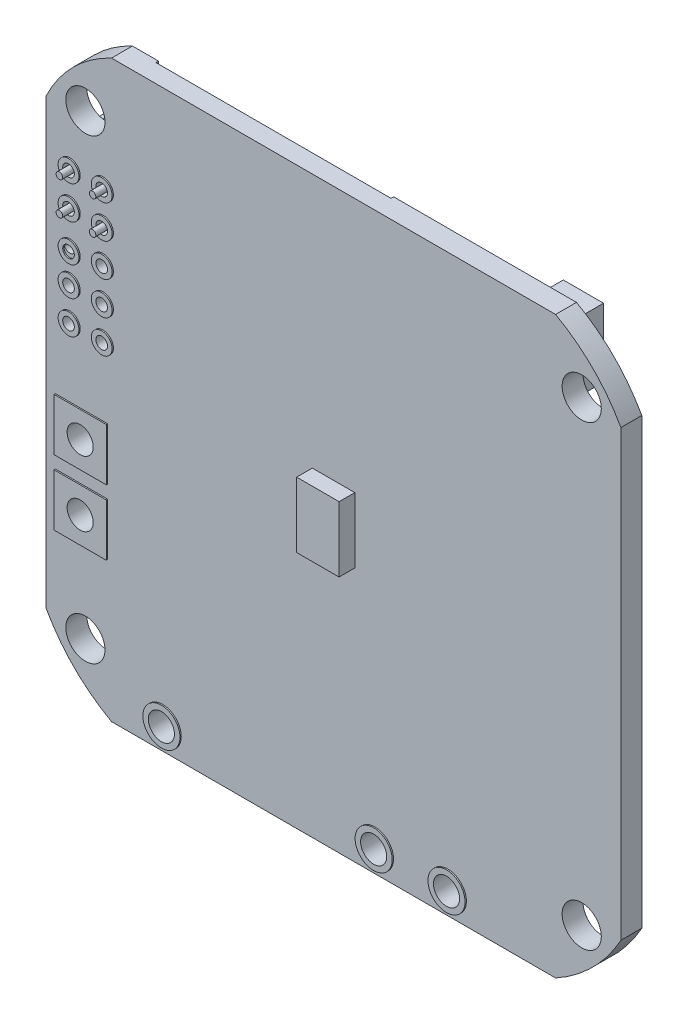
from build123d import *

# Parameters (mm, degrees)
SALIENTE_EXTRUIR1_DEPTH    = 0.8
CROQUIS2_R                 = 1.5
CORTAR_EXTRUIR1_DEPTH      = 32.153811966
CROQUIS3_W                 = 3.25
CROQUIS3_H                 = 5
SALIENTE_EXTRUIR2_DEPTH    = 1.2
CROQUIS4_R                 = 0.445
CORTAR_EXTRUIR2_DEPTH      = 32.238437861
CROQUIS5_R                 = 0.79739254
CROQUIS5_R_2               = 0.445
CROQUIS5_W                 = 4
CROQUIS5_H                 = 4
SALIENTE_EXTRUIR3_DEPTH    = 0.9
CORTAR_EXTRUIR3_DEPTH      = 32.247559905
CORTAR_EXTRUIR3_DEPTH_BACK = 32.247559905
CROQUIS6_R                 = 1
CROQUIS7_R                 = 1
CORTAR_EXTRUIR4_DEPTH      = 10
CROQUIS8_W                 = 3
CROQUIS8_H                 = 2.5
SALIENTE_EXTRUIR4_DEPTH    = 1.2
CROQUIS9_R                 = 0.75
SALIENTE_EXTRUIR5_DEPTH    = 0.8
CROQUIS10_W                = 5
CROQUIS10_H                = 5
SALIENTE_EXTRUIR6_DEPTH    = 0.9
SALIENTE_EXTRUIR7_START    = 0.1
CROQUIS11_R                = 1
SALIENTE_EXTRUIR7_DEPTH    = 0.1
SALIENTE_EXTRUIR8_DEPTH    = 0.75
CROQUIS13_W                = 3.080395022
CROQUIS13_H                = 5.233680862
SALIENTE_EXTRUIR9_DEPTH    = 2.65
CROQUIS14_W                = 3.82
CROQUIS14_H                = 3.82
SALIENTE_EXTRUIR10_DEPTH   = 3
CROQUIS30_R                = 1.419915385
CROQUIS30_R_2              = 1
SALIENTE_EXTRUIR17_DEPTH   = 0.1
CROQUIS29_W                = 3.5
CROQUIS29_H                = 1.5
SALIENTE_EXTRUIR16_DEPTH   = 0.5
CHAFL_N1_SIZE              = 1
CROQUIS31_W                = 18
CROQUIS31_H                = 19.35
CORTAR_EXTRUIR5_DEPTH      = 0.2
CROQUIS32_R                = 0.65
SALIENTE_EXTRUIR18_DEPTH   = 1.6
CROQUIS33_R                = 0.25
SALIENTE_EXTRUIR19_DEPTH   = 2.5
CROQUIS34_R                = 0.65
CROQUIS34_R_2              = 0.64
CROQUIS34_R_3              = 0.664142136
SALIENTE_EXTRUIR20_DEPTH   = 3


with BuildPart() as part:
    # Croquis1 → Saliente-Extruir1 (new, symmetric)
    with BuildSketch(Plane.XY):
        with BuildLine():
            Line((-22, 17), (-22, -17))
            ThreePointArc((-22, -17), (-19.853553391, -19.853553391), (-17, -22))
            Line((-17, -22), (17, -22))
            ThreePointArc((17, -22), (19.853553391, -19.853553391), (22, -17))
            Line((22, -17), (22, 17))
            ThreePointArc((22, 17), (19.853553391, 19.853553391), (17, 22))
            Line((17, 22), (-17, 22))
            ThreePointArc((-17, 22), (-19.933555475, 19.933555475), (-22, 17))
        make_face()
    extrude(amount=SALIENTE_EXTRUIR1_DEPTH, both=True)

    # Croquis2 → Cortar-Extruir1 (cut, through all)
    with BuildSketch(Plane.XY.offset(0.8)):
        with Locations((-19, 17.5)):
            Circle(CROQUIS2_R)
        with Locations((19, 17.5)):
            Circle(CROQUIS2_R)
        with Locations((19, -17.5)):
            Circle(CROQUIS2_R)
        with Locations((-19, -17.5)):
            Circle(CROQUIS2_R)
    extrude(amount=-CORTAR_EXTRUIR1_DEPTH, mode=Mode.SUBTRACT)

    # Croquis3 → Saliente-Extruir2 (add)
    with BuildSketch(Plane.XY.offset(0.8)):
        Rectangle(CROQUIS3_W, CROQUIS3_H)
    extrude(amount=SALIENTE_EXTRUIR2_DEPTH)

    # Croquis4 → Cortar-Extruir2 (cut, through all)
    with BuildSketch(Plane(origin=(0, 0, -0.8), x_dir=(-1, 0, 0), z_dir=(0, 0, -1))):
        with Locations((17.653, 13)):
            Circle(CROQUIS4_R)
        with Locations((20.193, 13)):
            Circle(CROQUIS4_R)
        with Locations((20.193, 10.46)):
            Circle(CROQUIS4_R)
        with Locations((20.193, 7.92)):
            Circle(CROQUIS4_R)
        with Locations((20.193, 5.38)):
            Circle(CROQUIS4_R)
        with Locations((20.193, 2.84)):
            Circle(CROQUIS4_R)
        with Locations((17.653, 10.46)):
            Circle(CROQUIS4_R)
        with Locations((17.653, 7.92)):
            Circle(CROQUIS4_R)
        with Locations((17.653, 5.38)):
            Circle(CROQUIS4_R)
        with Locations((17.653, 2.84)):
            Circle(CROQUIS4_R)
    extrude(amount=-CORTAR_EXTRUIR2_DEPTH, mode=Mode.SUBTRACT)

    # Croquis5 → Saliente-Extruir3 (add, symmetric)
    # profile 1 of 12: a face of its own
    with BuildSketch(Plane.XY):
        with Locations((-17.653, 2.84)):
            Circle(CROQUIS5_R)
        with Locations((-17.653, 2.84)):
            Circle(CROQUIS5_R_2, mode=Mode.SUBTRACT)
    # profile 2 of 12: a face of its own
    with BuildSketch(Plane.XY):
        with Locations((-20.193, 2.84)):
            Circle(CROQUIS5_R)
        with Locations((-20.193, 2.84)):
            Circle(CROQUIS5_R_2, mode=Mode.SUBTRACT)
    # profile 3 of 12: a face of its own
    with BuildSketch(Plane.XY):
        with Locations((-20.193, 5.38)):
            Circle(CROQUIS5_R)
        with Locations((-20.193, 5.38)):
            Circle(CROQUIS5_R_2, mode=Mode.SUBTRACT)
    # profile 4 of 12: a face of its own
    with BuildSketch(Plane.XY):
        with Locations((-17.653, 5.38)):
            Circle(CROQUIS5_R)
        with Locations((-17.653, 5.38)):
            Circle(CROQUIS5_R_2, mode=Mode.SUBTRACT)
    # profile 5 of 12: a face of its own
    with BuildSketch(Plane.XY):
        with Locations((-17.653, 7.92)):
            Circle(CROQUIS5_R)
        with Locations((-17.653, 7.92)):
            Circle(CROQUIS5_R_2, mode=Mode.SUBTRACT)
    # profile 6 of 12: a face of its own
    with BuildSketch(Plane.XY):
        with Locations((-17.653, 10.46)):
            Circle(CROQUIS5_R)
        with Locations((-17.653, 10.46)):
            Circle(CROQUIS5_R_2, mode=Mode.SUBTRACT)
    # profile 7 of 12: a face of its own
    with BuildSketch(Plane.XY):
        with Locations((-20.193, 7.62)):
            Circle(CROQUIS5_R)
        with Locations((-20.193, 7.62)):
            Circle(CROQUIS5_R_2, mode=Mode.SUBTRACT)
    # profile 8 of 12: a face of its own
    with BuildSketch(Plane.XY):
        with Locations((-20.193, 10.46)):
            Circle(CROQUIS5_R)
        with Locations((-20.193, 10.46)):
            Circle(CROQUIS5_R_2, mode=Mode.SUBTRACT)
    # profile 9 of 12: a face of its own
    with BuildSketch(Plane.XY):
        with Locations((-17.653, 13)):
            Circle(CROQUIS5_R)
        with Locations((-17.653, 13)):
            Circle(CROQUIS5_R_2, mode=Mode.SUBTRACT)
    # profile 10 of 12: a face of its own
    with BuildSketch(Plane.XY):
        with Locations((-20.193, 13)):
            Circle(CROQUIS5_R)
        with Locations((-20.193, 13)):
            Circle(CROQUIS5_R_2, mode=Mode.SUBTRACT)
    # profile 11 of 12: a face of its own
    with BuildSketch(Plane.XY):
        with Locations((-19.3, -4.4)):
            Rectangle(CROQUIS5_W, CROQUIS5_H)
    # profile 12 of 12: a face of its own
    with BuildSketch(Plane.XY):
        with Locations((-19.3, -9.4)):
            Rectangle(CROQUIS5_W, CROQUIS5_H)
    extrude(amount=SALIENTE_EXTRUIR3_DEPTH, both=True)

    # Croquis6 → Cortar-Extruir3 (cut, two sides: drawn at the far end of the back side and taken through both)
    with BuildSketch(Plane(origin=(0, 0, -0.9), x_dir=(-1, 0, 0), z_dir=(0, 0, -1)).offset(-CORTAR_EXTRUIR3_DEPTH_BACK)):
        with Locations((19.3, -4.4)):
            Circle(CROQUIS6_R)
        with Locations((19.3, -9.4)):
            Circle(CROQUIS6_R)
    extrude(amount=CORTAR_EXTRUIR3_DEPTH + CORTAR_EXTRUIR3_DEPTH_BACK, mode=Mode.SUBTRACT)

    # Croquis7 → Cortar-Extruir4 (cut)
    with BuildSketch(Plane(origin=(0, 0, -0.8), x_dir=(-1, 0, 0), z_dir=(0, 0, -1))):
        with Locations((-8.75, -20.32)):
            Circle(CROQUIS7_R)
        with Locations((-3.17, -20.32)):
            Circle(CROQUIS7_R)
        with Locations((13.08, -20.32)):
            Circle(CROQUIS7_R)
    extrude(amount=-CORTAR_EXTRUIR4_DEPTH, mode=Mode.SUBTRACT)

    # Croquis8 → Saliente-Extruir4 (add)
    with BuildSketch(Plane(origin=(0, 0, -0.8), x_dir=(-1, 0, 0), z_dir=(0, 0, -1))):
        with Locations((-19, 12.2)):
            Rectangle(CROQUIS8_W, CROQUIS8_H)
        with Locations((-19, 9.025)):
            Rectangle(CROQUIS8_W, CROQUIS8_H)
    extrude(amount=SALIENTE_EXTRUIR4_DEPTH)

    # Croquis9 → Saliente-Extruir5 (add)
    with BuildSketch(Plane(origin=(0, 0, -2), x_dir=(-1, 0, 0), z_dir=(0, 0, -1))):
        with Locations((-19, 12.2)):
            Circle(CROQUIS9_R)
        with Locations((-19, 9.025)):
            Circle(CROQUIS9_R)
    extrude(amount=SALIENTE_EXTRUIR5_DEPTH)

    # Croquis10 → Saliente-Extruir6 (add)
    with BuildSketch(Plane(origin=(0, 0, -0.8), x_dir=(-1, 0, 0), z_dir=(0, 0, -1))):
        with Locations((-13.5, -16.75)):
            Rectangle(CROQUIS10_W, CROQUIS10_H)
        with Locations((13.75, -14.7)):
            Rectangle(CROQUIS10_W, CROQUIS10_H)
        with Locations((8.387686328, -16.75)):
            Rectangle(CROQUIS10_W, CROQUIS10_H)
        with Locations((2.934297752, -16.75)):
            Rectangle(CROQUIS10_W, CROQUIS10_H)
        with Locations((-2.448267596, -14.7)):
            Rectangle(CROQUIS10_W, CROQUIS10_H)
        with Locations((-8.043302629, -14.7)):
            Rectangle(CROQUIS10_W, CROQUIS10_H)
    extrude(amount=SALIENTE_EXTRUIR6_DEPTH)

    # Croquis11 → Saliente-Extruir7 (add)
    # profile 1 of 3: a face of its own
    with BuildSketch(Plane(origin=(0, 0, -0.8), x_dir=(-1, 0, 0), z_dir=(0, 0, -1)).offset(SALIENTE_EXTRUIR7_START)):
        Polygon((-13.652894244, -19.522521794), (-10.45933095, -19.522521794), (-9.812366284, -18.875557129), (-7.528981863, -18.875557129), (-7.147566948, -19.256972043), (-7.147566948, -21.343674777), (-7.528981863, -21.725089692), (-13.830102074, -21.725089692), (-14.141358707, -21.413833058), (-14.141358707, -20.010986258), align=None)
        with Locations((-8.75, -20.32)):
            Circle(CROQUIS11_R, mode=Mode.SUBTRACT)
    # profile 2 of 3: a face of its own
    with BuildSketch(Plane(origin=(0, 0, -0.8), x_dir=(-1, 0, 0), z_dir=(0, 0, -1)).offset(SALIENTE_EXTRUIR7_START)):
        Polygon((8.172318821, -19.522521794), (11.198277852, -19.522521794), (12.022450347, -18.698349299), (14.296231203, -18.698349299), (14.77845979, -19.180577887), (14.77845979, -21.242861104), (14.296231203, -21.725089692), (7.995110992, -21.725089692), (7.683854358, -21.413833058), (7.683854358, -20.010986258), align=None)
        with Locations((13.08, -20.32)):
            Circle(CROQUIS11_R, mode=Mode.SUBTRACT)
    # profile 3 of 3: a face of its own
    with BuildSketch(Plane(origin=(0, 0, -0.8), x_dir=(-1, 0, 0), z_dir=(0, 0, -1)).offset(SALIENTE_EXTRUIR7_START)):
        Polygon((2.263089361, -20.010986258), (1.774624897, -19.522521794), (-1.418938397, -19.522521794), (-2.065903062, -18.875557129), (-4.349287484, -18.875557129), (-4.730702399, -19.256972043), (-4.730702399, -21.343674777), (-4.349287484, -21.725089692), (1.951832727, -21.725089692), (2.263089361, -21.413833058), align=None)
        with Locations((-3.17, -20.32)):
            Circle(CROQUIS11_R, mode=Mode.SUBTRACT)
    extrude(amount=-SALIENTE_EXTRUIR7_DEPTH)

    # Croquis12 → Saliente-Extruir8 (add)
    with BuildSketch(Plane(origin=(0, 0, -0.8), x_dir=(-1, 0, 0), z_dir=(0, 0, -1))):
        Polygon((-19.575208836, -2.789767852), (-13.48447481, -8.880501877), (-7.393740785, -2.789767852), (-13.48447481, 3.300966173), align=None)
    extrude(amount=SALIENTE_EXTRUIR8_DEPTH)

    # Croquis13 → Saliente-Extruir9 (add)
    with BuildSketch(Plane(origin=(0, 0, -0.8), x_dir=(-1, 0, 0), z_dir=(0, 0, -1))):
        with Locations((-14.88146784, 17.715085573)):
            Rectangle(CROQUIS13_W, CROQUIS13_H)
    extrude(amount=SALIENTE_EXTRUIR9_DEPTH)

    # Croquis14 → Saliente-Extruir10 (add)
    with BuildSketch(Plane(origin=(0, 0, -0.8), x_dir=(-1, 0, 0), z_dir=(0, 0, -1))):
        with Locations((-10.141101814, 15.498369959)):
            Rectangle(CROQUIS14_W, CROQUIS14_H)
    extrude(amount=SALIENTE_EXTRUIR10_DEPTH)

    # Croquis30 → Saliente-Extruir17 (add)
    # profile 1 of 3: a face of its own
    with BuildSketch(Plane.XY.offset(0.8)):
        with Locations((-13.08, -20.32)):
            Circle(CROQUIS30_R)
        with Locations(Location((-13.08, -20.32, 0), (0, 0, 180))):
            Circle(CROQUIS30_R_2, mode=Mode.SUBTRACT)
    # profile 2 of 3: a face of its own
    with BuildSketch(Plane.XY.offset(0.8)):
        with Locations((8.75, -20.32)):
            Circle(CROQUIS30_R)
        with Locations(Location((8.75, -20.32, 0), (0, 0, 180))):
            Circle(CROQUIS30_R_2, mode=Mode.SUBTRACT)
    # profile 3 of 3: a face of its own
    with BuildSketch(Plane.XY.offset(0.8)):
        with Locations((3.17, -20.32)):
            Circle(CROQUIS30_R)
        with Locations(Location((3.17, -20.32, 0), (0, 0, 180))):
            Circle(CROQUIS30_R_2, mode=Mode.SUBTRACT)
    extrude(amount=SALIENTE_EXTRUIR17_DEPTH)

    # Croquis29 → Saliente-Extruir16 (add)
    with BuildSketch(Plane(origin=(0, 0, -0.8), x_dir=(-1, 0, 0), z_dir=(0, 0, -1))):
        with Locations((12.25, 0.75)):
            Rectangle(CROQUIS29_W, CROQUIS29_H)
        with Locations((12.25, -1.4)):
            Rectangle(CROQUIS29_W, CROQUIS29_H)
        with Locations((4.5, 0.75)):
            Rectangle(CROQUIS29_W, CROQUIS29_H)
    extrude(amount=SALIENTE_EXTRUIR16_DEPTH)

    # Chaflán1
    chafl_n1_edges = [part.edges().sort_by_distance(p)[0] for p in [
        (12.051101814, 17.408369959, -2.3),
        (12.051101814, 13.588369959, -2.3),
        (8.231101814, 13.588369959, -2.3),
        (8.231101814, 17.408369959, -2.3),
    ]]
    chamfer(chafl_n1_edges, length=CHAFL_N1_SIZE)

    # Croquis31 → Cortar-Extruir5 (cut)
    with BuildSketch(Plane(origin=(0, 0, -0.8), x_dir=(-1, 0, 0), z_dir=(0, 0, -1))):
        with Locations((6, 12.325)):
            Rectangle(CROQUIS31_W, CROQUIS31_H)
    extrude(amount=-CORTAR_EXTRUIR5_DEPTH, mode=Mode.SUBTRACT)

    # Croquis32 → Saliente-Extruir18 (add)
    with BuildSketch(Plane(origin=(0, 0, -0.9), x_dir=(-1, 0, 0), z_dir=(0, 0, -1))):
        with Locations((17.653, 13)):
            Circle(CROQUIS32_R)
        with Locations((20.193, 13)):
            Circle(CROQUIS32_R)
        with Locations((20.193, 10.46)):
            Circle(CROQUIS32_R)
        with Locations((17.653, 10.46)):
            Circle(CROQUIS32_R)
    extrude(amount=SALIENTE_EXTRUIR18_DEPTH)

    # Croquis33 → Saliente-Extruir19 (add)
    with BuildSketch(Plane.XY.offset(-0.9)):
        with Locations(Location((-20.193, 13, 0), (0, 0, 180))):
            Circle(CROQUIS33_R)
        with Locations(Location((-17.653, 13, 0), (0, 0, 180))):
            Circle(CROQUIS33_R)
        with Locations(Location((-17.653, 10.46, 0), (0, 0, 180))):
            Circle(CROQUIS33_R)
        with Locations(Location((-20.193, 10.46, 0), (0, 0, 180))):
            Circle(CROQUIS33_R)
    extrude(amount=SALIENTE_EXTRUIR19_DEPTH)

    # Croquis34 → Saliente-Extruir20 (add)
    # profile 1 of 4: a face of its own
    with BuildSketch(Plane(origin=(0, 0, -2.5), x_dir=(-1, 0, 0), z_dir=(0, 0, -1))):
        Polygon((16.388, 14.110187818), (16.388, 11.920171354), (16.872841707, 11.735), (18.422628322, 11.735), (18.918, 11.889812182), (18.918, 14.110187818), (18.433158293, 14.265), (16.872841707, 14.265), align=None)
        with Locations((17.653, 13)):
            Circle(CROQUIS34_R, mode=Mode.SUBTRACT)
    # profile 2 of 4: a face of its own
    with BuildSketch(Plane(origin=(0, 0, -2.5), x_dir=(-1, 0, 0), z_dir=(0, 0, -1))):
        Polygon((18.96561914, 14.110187818), (18.96561914, 11.920171354), (19.450460847, 11.735), (21.000247463, 11.735), (21.49561914, 11.889812182), (21.49561914, 14.110187818), (21.010777434, 14.265), (19.450460847, 14.265), align=None)
        with Locations(Location((20.23061914, 13, 0), (0, 0, 76.201448094))):
            Circle(CROQUIS34_R_2, mode=Mode.SUBTRACT)
    # profile 3 of 4: a face of its own
    with BuildSketch(Plane(origin=(0, 0, -2.5), x_dir=(-1, 0, 0), z_dir=(0, 0, -1))):
        Polygon((18.96561914, 11.529019734), (18.96561914, 9.33900327), (19.450460847, 9.153831916), (21.000247463, 9.153831916), (21.49561914, 9.308644098), (21.49561914, 11.529019734), (21.010777434, 11.683831916), (19.450460847, 11.683831916), align=None)
        with Locations(Location((20.23061914, 10.418831916, 0), (0, 0, 205.390672838))):
            Circle(CROQUIS34_R_3, mode=Mode.SUBTRACT)
    # profile 4 of 4: a face of its own
    with BuildSketch(Plane(origin=(0, 0, -2.5), x_dir=(-1, 0, 0), z_dir=(0, 0, -1))):
        Polygon((16.388, 11.529019734), (16.388, 9.33900327), (16.872841707, 9.153831916), (18.422628322, 9.153831916), (18.918, 9.308644098), (18.918, 11.529019734), (18.433158293, 11.683831916), (16.872841707, 11.683831916), align=None)
        with Locations(Location((17.653, 10.418831916, 0), (0, 0, 192.277211152))):
            Circle(CROQUIS34_R_2, mode=Mode.SUBTRACT)
    extrude(amount=SALIENTE_EXTRUIR20_DEPTH)


with BuildPart() as saliente_extruir20_piece_1:
    # of the separate pieces the step leaves, piece 1, a body of its own (saliente_extruir20_pieces)
    add(part.part.solids().sort_by_distance((-17, 22, -0.8))[0])


with BuildPart() as saliente_extruir20_piece_2:
    # of the separate pieces the step leaves, piece 2, a body of its own (saliente_extruir20_pieces)
    add(part.part.solids().sort_by_distance((-18.303, 13, -5.5))[0])


solid = Compound([saliente_extruir20_piece_1.part, saliente_extruir20_piece_2.part])
